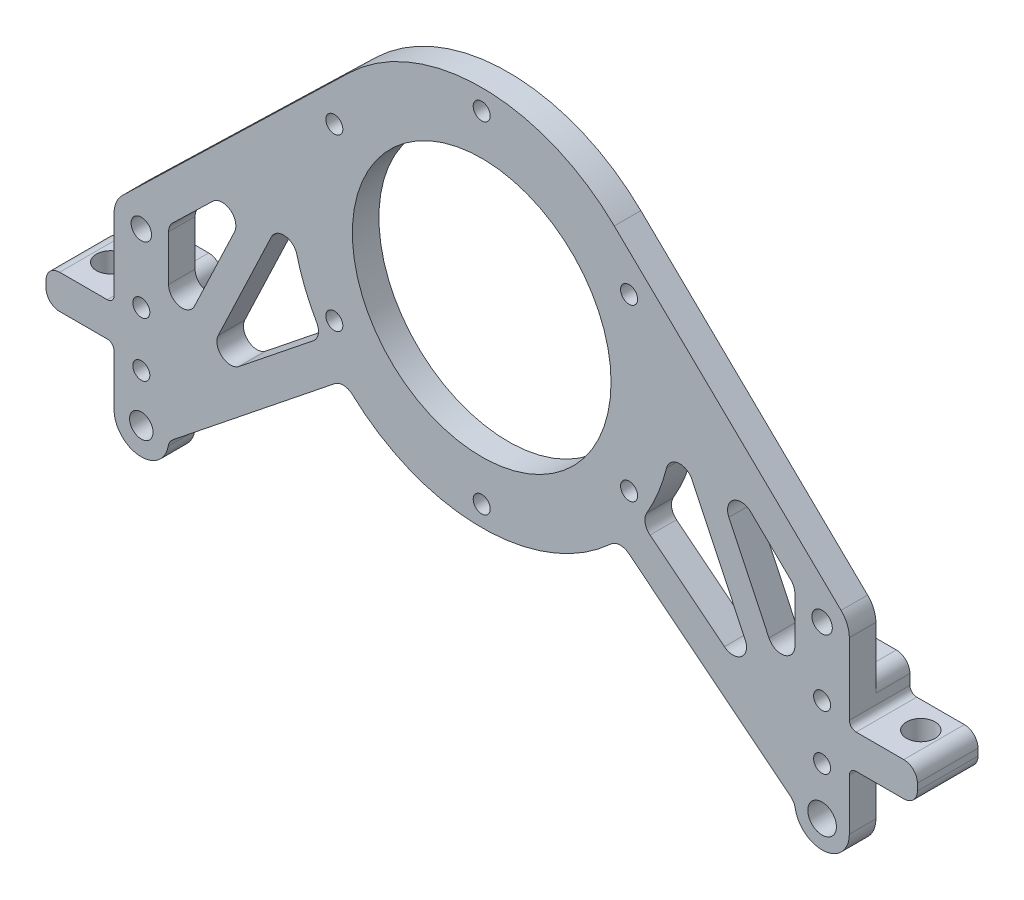
from build123d import *

# Parameters (mm, degrees)
SKETCH_1_R          = 28
SKETCH_1_R_2        = 19
SKETCH_1_R_3        = 1.25
EXTRUDE_1_DEPTH     = 3.9
SKETCH_2_R          = 2.1
SKETCH_2_R_2        = 1.726470001
EXTRUDE_2_DEPTH     = 3.9
CUT_EXTRUDE_2_DEPTH = 3.9
EXTRUDE_4_DEPTH     = 3.9
FILLET_4_R          = 2
SKETCH_7_R          = 1.5
SKETCH_7_R_2        = 1.25
CUT_EXTRUDE_4_DEPTH = 3.9
EXTRUDE_START       = -3.9
SKETCH_8_W          = 7
SKETCH_8_H          = 14
SKETCH_8_R          = 1.5
SKETCH_8_W_2        = 10
SKETCH_8_H_2        = 5
EXTRUDE_5_DEPTH     = 5
EXTRUDE_START_2     = -5
SKETCH_9_W          = 10
SKETCH_9_H          = 5
EXTRUDE_6_DEPTH     = 3.9
SKETCH_10_R         = 2.1
CUT_EXTRUDE_5_DEPTH = 5
FILLET_5_R          = 2
FILLET_6_R          = 1


with BuildPart() as part:
    # 草图1 → 凸台-拉伸1 (new body)
    with BuildSketch(Plane.XY):
        Circle(SKETCH_1_R)
        Circle(SKETCH_1_R_2, mode=Mode.SUBTRACT)
        with Locations((0, 25)):
            Circle(SKETCH_1_R_3, mode=Mode.SUBTRACT)
        with Locations((21.650635095, 12.5)):
            Circle(SKETCH_1_R_3, mode=Mode.SUBTRACT)
        with Locations((21.650635095, -12.5)):
            Circle(SKETCH_1_R_3, mode=Mode.SUBTRACT)
        with Locations((0, -25)):
            Circle(SKETCH_1_R_3, mode=Mode.SUBTRACT)
        with Locations((-21.650635095, -12.5)):
            Circle(SKETCH_1_R_3, mode=Mode.SUBTRACT)
        with Locations((-21.650635095, 12.5)):
            Circle(SKETCH_1_R_3, mode=Mode.SUBTRACT)
    extrude(amount=EXTRUDE_1_DEPTH)

    # 草图2 → 凸台-拉伸2 (add)
    # profile 1 of 10: a face of its own
    with BuildSketch(Plane(origin=(0, 0, 0), x_dir=(-1, 0, 0), z_dir=(0, 0, -1))):
        with BuildLine():
            ThreePointArc((-52.782179258, -12.126069142), (-48.439345815, -11.317017715), (-46, -15))
            Line((-46, -15), (-26.826428926, -8.021390844))
            ThreePointArc((-26.826428926, -8.021390844), (-27.090791771, 7.077358352), (-19.475254803, 20.117516009))
            Line((-19.475254803, 20.117516009), (-52.782179258, -12.126069142))
        make_face()
    # profile 2 of 10: a face of its own
    with BuildSketch(Plane(origin=(0, 0, 0), x_dir=(-1, 0, 0), z_dir=(0, 0, -1))):
        with BuildLine():
            Line((-46, -33.598437881), (-46, -15))
            ThreePointArc((-46, -15), (-48.439345815, -11.317017715), (-52.782179258, -12.126069142))
            ThreePointArc((-52.782179258, -12.126069142), (-53.682982285, -13.439345815), (-54, -15))
            Line((-54, -15), (-54, -40))
            ThreePointArc((-54, -40), (-50.000781181, -43.999999924), (-46.000000305, -40.001562363))
            Line((-46.000000305, -40.001562363), (-48.438262381, -41.952172024))
            ThreePointArc((-48.438262381, -41.952172024), (-51.952172024, -41.561737619), (-51.561737619, -38.047827976))
            Line((-51.561737619, -38.047827976), (-46, -33.598437881))
        make_face()
    # profile 3 of 10: a face of its own
    with BuildSketch(Plane(origin=(0, 0, 0), x_dir=(-1, 0, 0), z_dir=(0, 0, -1))):
        with BuildLine():
            Line((-23.338739361, -15.46942937), (-46, -33.598437881))
            Line((-46, -33.598437881), (-46, -40))
            ThreePointArc((-46, -40), (-46.000000076, -40.000781181), (-46.000000305, -40.001562363))
            Line((-46.000000305, -40.001562363), (-20.215264123, -19.373773417))
            ThreePointArc((-20.215264123, -19.373773417), (-21.864326664, -17.491461332), (-23.338739361, -15.46942937))
        make_face()
    # profile 4 of 10: a face of its own
    with BuildSketch(Plane(origin=(0, 0, 0), x_dir=(-1, 0, 0), z_dir=(0, 0, -1))):
        with BuildLine():
            Line((-46, -40), (-46, -33.598437881))
            Line((-46, -33.598437881), (-51.561737619, -38.047827976))
            ThreePointArc((-51.561737619, -38.047827976), (-51.952172024, -41.561737619), (-48.438262381, -41.952172024))
            Line((-48.438262381, -41.952172024), (-46.000000305, -40.001562363))
            ThreePointArc((-46.000000305, -40.001562363), (-46.000000076, -40.000781181), (-46, -40))
        make_face()
        with Locations((-50, -40)):
            Circle(SKETCH_2_R, mode=Mode.SUBTRACT)
    # profile 5 of 10: a face of its own
    with BuildSketch(Plane(origin=(0, 0, 0), x_dir=(-1, 0, 0), z_dir=(0, 0, -1))):
        with BuildLine():
            ThreePointArc((23.338739361, -15.46942937), (21.864326664, -17.491461332), (20.215264123, -19.373773417))
            Line((20.215264123, -19.373773417), (46.000000305, -40.001562363))
            ThreePointArc((46.000000305, -40.001562363), (46.000000076, -40.000781181), (46, -40))
            Line((46, -40), (46, -33.598437881))
            Line((46, -33.598437881), (23.338739361, -15.46942937))
        make_face()
    # profile 6 of 10: a face of its own
    with BuildSketch(Plane(origin=(0, 0, 0), x_dir=(-1, 0, 0), z_dir=(0, 0, -1))):
        with BuildLine():
            ThreePointArc((54, -15), (53.682982285, -13.439345815), (52.782179258, -12.126069142))
            ThreePointArc((52.782179258, -12.126069142), (48.439345815, -11.317017715), (46, -15))
            Line((46, -15), (46, -33.598437881))
            Line((46, -33.598437881), (51.561737619, -38.047827976))
            ThreePointArc((51.561737619, -38.047827976), (51.952172024, -41.561737619), (48.438262381, -41.952172024))
            Line((48.438262381, -41.952172024), (46.000000305, -40.001562363))
            ThreePointArc((46.000000305, -40.001562363), (50.000781181, -43.999999924), (54, -40))
            Line((54, -40), (54, -15))
        make_face()
    # profile 7 of 10: a face of its own
    with BuildSketch(Plane(origin=(0, 0, 0), x_dir=(-1, 0, 0), z_dir=(0, 0, -1))):
        with BuildLine():
            Line((52.782179258, -12.126069142), (19.475254803, 20.117516009))
            ThreePointArc((19.475254803, 20.117516009), (25.780875998, 10.924579295), (28, 0))
            ThreePointArc((28, 0), (27.70505378, -4.053393028), (26.826428926, -8.021390844))
            Line((26.826428926, -8.021390844), (46, -15))
            ThreePointArc((46, -15), (48.439345815, -11.317017715), (52.782179258, -12.126069142))
        make_face()
    # profile 8 of 10: a face of its own
    with BuildSketch(Plane(origin=(0, 0, 0), x_dir=(-1, 0, 0), z_dir=(0, 0, -1))):
        with BuildLine():
            ThreePointArc((46, -40), (46.000000076, -40.000781181), (46.000000305, -40.001562363))
            Line((46.000000305, -40.001562363), (48.438262381, -41.952172024))
            ThreePointArc((48.438262381, -41.952172024), (51.952172024, -41.561737619), (51.561737619, -38.047827976))
            Line((51.561737619, -38.047827976), (46, -33.598437881))
            Line((46, -33.598437881), (46, -40))
        make_face()
        with Locations((50, -40)):
            Circle(SKETCH_2_R_2, mode=Mode.SUBTRACT)
    # profile 9 of 10: a face of its own
    with BuildSketch(Plane(origin=(0, 0, 0), x_dir=(-1, 0, 0), z_dir=(0, 0, -1))):
        with BuildLine():
            Line((-26.826428926, -8.021390844), (-46, -15))
            Line((-46, -15), (-46, -33.598437881))
            Line((-46, -33.598437881), (-23.338739361, -15.46942937))
            ThreePointArc((-23.338739361, -15.46942937), (-25.357530376, -11.874159053), (-26.826428926, -8.021390844))
        make_face()
    # profile 10 of 10: a face of its own
    with BuildSketch(Plane(origin=(0, 0, 0), x_dir=(-1, 0, 0), z_dir=(0, 0, -1))):
        with BuildLine():
            Line((46, -33.598437881), (46, -15))
            Line((46, -15), (26.826428926, -8.021390844))
            ThreePointArc((26.826428926, -8.021390844), (25.357530376, -11.874159053), (23.338739361, -15.46942937))
            Line((23.338739361, -15.46942937), (46, -33.598437881))
        make_face()
    extrude(amount=-EXTRUDE_2_DEPTH)

    # 草图4 → 切除-拉伸2 (cut)
    with BuildSketch(Plane(origin=(0, 0, 0), x_dir=(-1, 0, 0), z_dir=(0, 0, -1))):
        with BuildLine():
            ThreePointArc((-23.338739361, -15.46942937), (-27.467698641, -5.433740088), (-27.47077961, 5.418142449))
            Line((-27.47077961, 5.418142449), (-46, -12.519523822))
            Line((-46, -12.519523822), (-46, -15))
            Line((-46, -15), (-46, -33.598437881))
            Line((-46, -33.598437881), (-23.338739361, -15.46942937))
        make_face()
        with BuildLine():
            Line((46, -12.519523822), (27.47077961, 5.418142449))
            ThreePointArc((27.47077961, 5.418142449), (27.867380834, 2.721963529), (28, 0))
            ThreePointArc((28, 0), (26.809370583, -8.078220655), (23.338739361, -15.46942937))
            Line((23.338739361, -15.46942937), (46, -33.598437881))
            Line((46, -33.598437881), (46, -15))
            Line((46, -15), (46, -12.519523822))
        make_face()
    extrude(amount=-CUT_EXTRUDE_2_DEPTH, mode=Mode.SUBTRACT)

    # 草图5 → 凸台-拉伸4 (add)
    with BuildSketch(Plane(origin=(0, 0, 0), x_dir=(-1, 0, 0), z_dir=(0, 0, -1))):
        with BuildLine():
            Line((-47.806620599, -32.74046235), (-29.277400209, 6.27611798))
            ThreePointArc((-29.277400209, 6.27611798), (-26.612804079, 7.224763048), (-25.664159012, 4.560166918))
            Line((-25.664159012, 4.560166918), (-44.193379401, -34.456413412))
            ThreePointArc((-44.193379401, -34.456413412), (-46.857975531, -35.40505848), (-47.806620599, -32.74046235))
        make_face()
        with BuildLine():
            Line((29.277400209, 6.27611798), (47.806620599, -32.74046235))
            ThreePointArc((47.806620599, -32.74046235), (46.857975531, -35.40505848), (44.193379401, -34.456413412))
            Line((44.193379401, -34.456413412), (25.664159012, 4.560166918))
            ThreePointArc((25.664159012, 4.560166918), (26.612804079, 7.224763048), (29.277400209, 6.27611798))
        make_face()
    extrude(amount=-EXTRUDE_4_DEPTH)

    # 圆角4
    fillet_4_edges = [part.edges().sort_by_distance(p)[0] for p in [
        (-23.338739361, -15.46942937, 1.95),
        (-46, -12.519523822, 1.95),
        (31.568987667, 1.450771621, 1.95),
        (42.429337125, -30.741907581, 1.95),
        (46, -28.936300263, 1.95),
        (27.997766422, -0.35365995, 1.95),
        (-42.429337125, -30.741907581, 1.95),
        (-46, -28.936300263, 1.95),
        (-31.568987667, 1.450771621, 1.95),
        (-27.997766422, -0.35365995, 1.95),
        (20.215264123, -19.373773417, 1.95),
        (46.000000305, -40.001562363, 1.95),
        (-46.000000305, -40.001562363, 1.95),
        (-20.215264123, -19.373773417, 1.95),
        (23.338739361, -15.46942937, 1.95),
        (46, -12.519523822, 1.95),
    ]]
    fillet(fillet_4_edges, radius=FILLET_4_R)

    # 草图7 → 切除-拉伸4 (cut)
    with BuildSketch(Plane.XY.offset(3.9)):
        with Locations((-50, -15)):
            Circle(SKETCH_7_R)
        with Locations((-50, -33)):
            Circle(SKETCH_7_R_2)
        with Locations((-50, -25)):
            Circle(SKETCH_7_R_2)
        with Locations(Location((50, -15, 0), (0, 0, 180))):
            Circle(SKETCH_7_R)
        with Locations(Location((50, -25, 0), (0, 0, 180))):
            Circle(SKETCH_7_R_2)
        with Locations(Location((50, -33, 0), (0, 0, 180))):
            Circle(SKETCH_7_R_2)
    extrude(amount=-CUT_EXTRUDE_4_DEPTH, mode=Mode.SUBTRACT)

    # 草图8 → 凸台-拉伸5 (add)
    # profile 1 of 4: a face of its own
    with BuildSketch(Plane.XY.offset(3.9).offset(EXTRUDE_START)):
        with Locations((50.5, -29)):
            Rectangle(SKETCH_8_W, SKETCH_8_H)
        with Locations((50, -33)):
            Circle(SKETCH_8_R, mode=Mode.SUBTRACT)
        with Locations((50, -25)):
            Circle(SKETCH_8_R, mode=Mode.SUBTRACT)
    # profile 2 of 4: a face of its own
    with BuildSketch(Plane.XY.offset(3.9).offset(EXTRUDE_START)):
        with Locations((59, -29)):
            Rectangle(SKETCH_8_W_2, SKETCH_8_H_2)
    # profile 3 of 4: a face of its own
    with BuildSketch(Plane.XY.offset(3.9).offset(EXTRUDE_START)):
        Polygon((-54, -26.5), (-54, -31.5), (-54, -36), (-47, -36), (-47, -22), (-54, -22), align=None)
        with Locations((-50, -33)):
            Circle(SKETCH_8_R, mode=Mode.SUBTRACT)
        with Locations((-50, -25)):
            Circle(SKETCH_8_R, mode=Mode.SUBTRACT)
    # profile 4 of 4: a face of its own
    with BuildSketch(Plane.XY.offset(3.9).offset(EXTRUDE_START)):
        with Locations((-59, -29)):
            Rectangle(SKETCH_8_W_2, SKETCH_8_H_2)
    extrude(amount=-EXTRUDE_5_DEPTH)

    # 草图9 → 凸台-拉伸6 (add)
    with BuildSketch(Plane(origin=(0, 0, -5), x_dir=(-1, 0, 0), z_dir=(0, 0, -1)).offset(EXTRUDE_START_2)):
        with Locations((-59, -29)):
            Rectangle(SKETCH_9_W, SKETCH_9_H)
        with Locations((59, -29)):
            Rectangle(SKETCH_9_W, SKETCH_9_H)
    extrude(amount=-EXTRUDE_6_DEPTH)

    # 草图10 → 切除-拉伸5 (cut)
    with BuildSketch(Plane.XZ.offset(31.5)):
        with Locations((59.5, -1.1)):
            Circle(SKETCH_10_R)
    cut_extrude_5 = extrude(amount=-CUT_EXTRUDE_5_DEPTH, mode=Mode.SUBTRACT)

    # 圆角5
    fillet_5_edges = [part.edges().sort_by_distance(p)[0] for p in [
        (54, -36, -2.5),
        (47, -36, -2.5),
        (47, -22, -2.5),
        (54, -22, -2.5),
        (64, -26.5, -0.55),
        (64, -31.5, -0.55),
        (-54, -36, -2.5),
        (-64, -31.5, -0.55),
        (-64, -26.5, -0.55),
        (-54, -22, -2.5),
        (-47, -22, -2.5),
        (-47, -36, -2.5),
    ]]
    fillet(fillet_5_edges, radius=FILLET_5_R)

    # 圆角6
    fillet_6_edges = [part.edges().sort_by_distance(p)[0] for p in [
        (54, -31.5, -0.55),
        (54, -26.5, -0.55),
        (-54, -31.5, -0.55),
        (-54, -26.5, -0.55),
    ]]
    fillet(fillet_6_edges, radius=FILLET_6_R)

    # 镜向9: 切除-拉伸5 across plane
    add(cut_extrude_5.mirror(Plane(origin=(0, 0, 0), x_dir=(0, 0, 1), z_dir=(1, 0, 0))), mode=Mode.SUBTRACT)


solid = part.part
